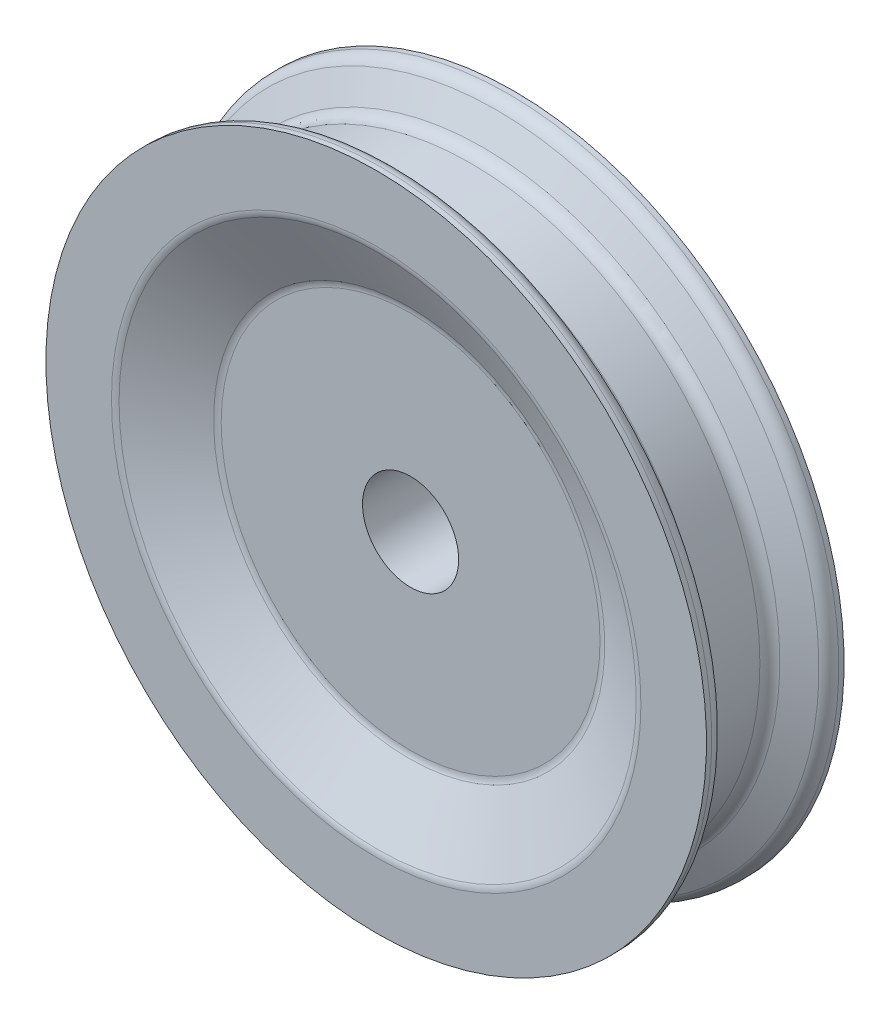
from build123d import *

# Parameters (mm, degrees)
FILLETS_R            = 5
SHAFT_CUT_DEPTH      = 174.799455871
SHAFT_CUT_DEPTH_BACK = 174.799455871
SKETCH3_R            = 17.4625


with BuildPart() as part:
    # Sketch1 → Main wheel extrude (revolve)
    with BuildSketch(Plane(origin=(0, 0, 0), x_dir=(0, 0, -1), z_dir=(1, 0, 0)), mode=Mode.PRIVATE) as main_wheel_extrude_sk:
        Polygon((-25, 120), (-25, 95), (-12.5, 70), (-12.5, 0), (12.5, 0), (12.5, 70), (25, 95), (25, 120), (20, 120), (12.5, 105), (-12.5, 105), (-20, 120), align=None)
    revolve(main_wheel_extrude_sk.sketch.rotate(Axis((0, 0, 12.5), (0, 0, -1)), 180), axis=Axis((0, 0, 12.5), (0, 0, -1)))

    # Fillets
    fillets_edges = [part.edges().sort_by_distance(p)[0] for p in [
        (0, 105, -12.5),
        (0, 120, -20),
        (0, 95, -25),
        (0, 70, -12.5),
        (0, 70, 12.5),
        (0, 95, 25),
        (0, 120, 20),
        (0, 105, 12.5),
    ]]
    fillet(fillets_edges, radius=FILLETS_R)

    # Sketch3 → Shaft cut (cut, two sides: drawn at the far end of the back side and taken through both)
    with BuildSketch(Plane(origin=(0, 0, -12.5), x_dir=(-1, 0, 0), z_dir=(0, 0, -1)).offset(-SHAFT_CUT_DEPTH_BACK)):
        with Locations(Location((0, 0, 0), (0, 0, 90))):
            Circle(SKETCH3_R)
    extrude(amount=SHAFT_CUT_DEPTH + SHAFT_CUT_DEPTH_BACK, mode=Mode.SUBTRACT)


solid = part.part
